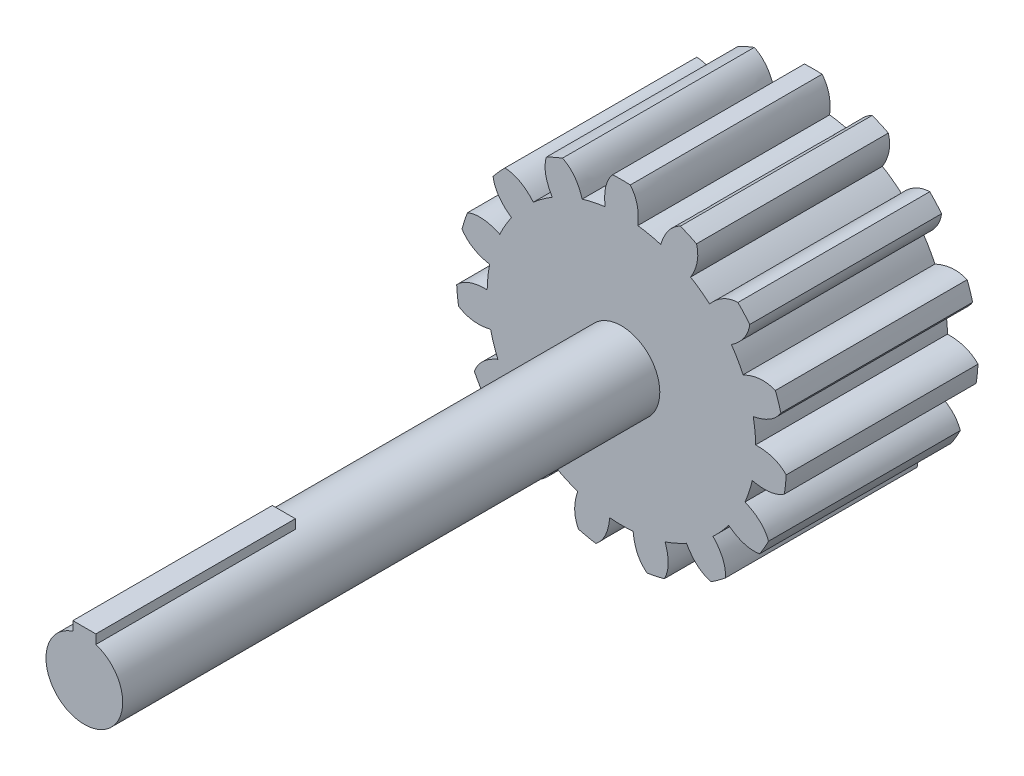
from build123d import *

# Parameters (mm, degrees)
SKETCH_2_R               = 17.5
EXTRUDE_2_DEPTH          = 25
EXTRUDE_3_DEPTH          = 25
PATTERN_CIRCULAR_1_COUNT = 15
SKETCH_3_R               = 5
EXTRUDE_4_DEPTH          = 70
EXTRUDE_START            = -26
EXTRUDE_5_DEPTH          = 26


with BuildPart() as part:
    # 草图2 → 凸台-拉伸2 (new body)
    with BuildSketch(Plane.XY):
        Circle(SKETCH_2_R)
    extrude(amount=EXTRUDE_2_DEPTH)

    # 草图4 → 凸台-拉伸3 (add)
    with BuildSketch(Plane(origin=(0, 0, 0), x_dir=(-1, 0, 0), z_dir=(0, 0, -1))):
        with BuildLine():
            ThreePointArc((1.152655242, 21.469079764), (0, 21.5), (-1.152655242, 21.469079764))
            add(Edge.make_bspline(
                [(-2.13271351, 17.369557654), (-2.448019627, 19.937519908), (-1.152655242, 21.469079764)],
                knots=[0, 0, 0, 0.686911927, 0.686911927, 0.686911927], degree=2))
            ThreePointArc((-2.13271351, 17.369557654), (0, 17.5), (2.13271351, 17.369557654))
            add(Edge.make_bspline(
                [(2.13271351, 17.369557654), (2.448019627, 19.937519908), (1.152655242, 21.469079764)],
                knots=[0, 0, 0, 0.686911927, 0.686911927, 0.686911927], degree=2))
        make_face()
    extrude_3 = extrude(amount=-EXTRUDE_3_DEPTH)

    # 阵列(圆周)1: 凸台-拉伸3 ×15 about axis
    pattern_circular_1_axis = Axis((0, 0, 0), (0, 0, 1))
    for i in range(1, PATTERN_CIRCULAR_1_COUNT):
        add(extrude_3.rotate(pattern_circular_1_axis, i * 360 / PATTERN_CIRCULAR_1_COUNT))

    # 草图3 → 凸台-拉伸4 (add)
    with BuildSketch(Plane.XY.offset(25)):
        Circle(SKETCH_3_R)
    extrude(amount=EXTRUDE_4_DEPTH)

    # 草图7 → 凸台-拉伸5 (add)
    with BuildSketch(Plane.XY.offset(95).offset(EXTRUDE_START)):
        with BuildLine():
            Line((1.5, 4.769696007), (1.5, 5.969696007))
            Line((1.5, 5.969696007), (-1.5, 5.969696007))
            Line((-1.5, 5.969696007), (-1.5, 4.769696007))
            ThreePointArc((-1.5, 4.769696007), (0, 5), (1.5, 4.769696007))
        make_face()
    extrude(amount=EXTRUDE_5_DEPTH)


solid = part.part
